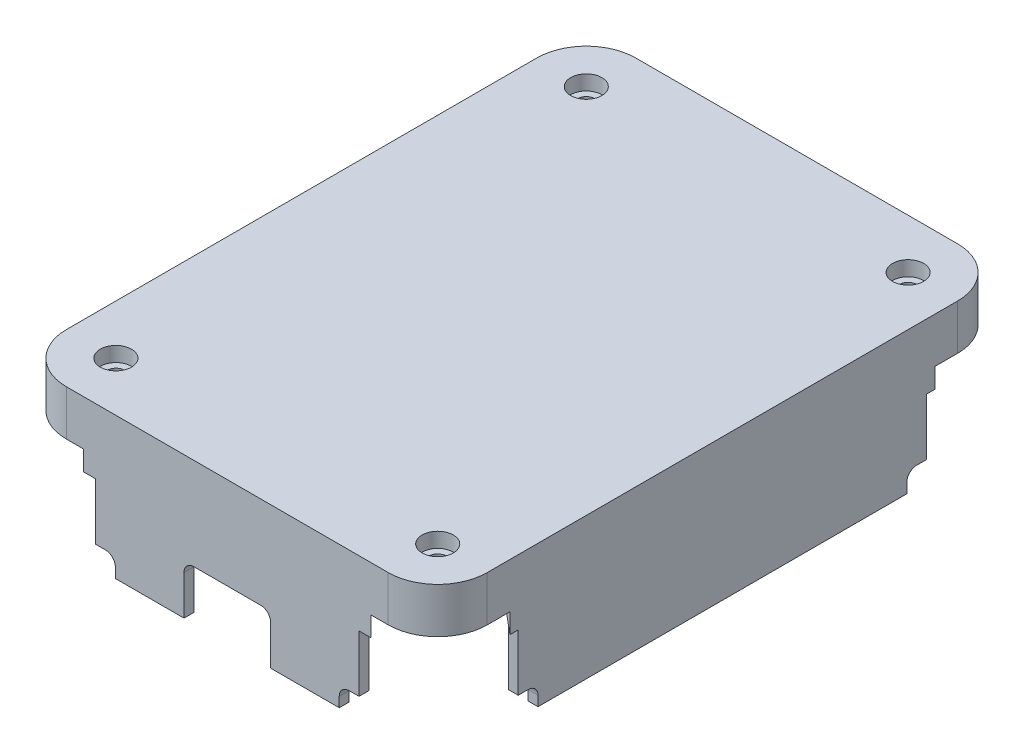
from build123d import *

# Parameters (mm, degrees)
SKETCH1_W               = 107.95
SKETCH1_H               = 146.05
BOSS_EXTRUDE1_DEPTH     = 2.54
SKETCH13_W              = 25.4
SKETCH13_H              = 25.4
BOSS_EXTRUDE4_DEPTH     = 16.71066
SKETCH2_R               = 3.302
CUT_EXTRUDE1_DEPTH      = 93.331995579
FILLET1_R               = 12.7
CUT_EXTRUDE13_DEPTH     = 5.08
SKETCH15_R              = 6.35
BOSS_EXTRUDE5_DEPTH     = 9.09066
SKETCH23_R              = 2.25
CUT_EXTRUDE14_DEPTH     = 92.549022398
SKETCH24_R              = 4
CUT_EXTRUDE15_DEPTH     = 3.81
MIRROR2_COPY_1_SKETCH_R = 2.25
MIRROR2_COPY_1_DEPTH    = 92.549022398
MIRROR2_COPY_2_SKETCH_R = 4
MIRROR2_COPY_2_DEPTH    = 3.81
FILLET3_R               = 12.7
FILLET4_R               = 1.016
SKETCH27_W              = 67.577845754
SKETCH27_H              = 2.54
SKETCH27_W_2            = 2.54
SKETCH27_H_2            = 104.761072196
BOSS_EXTRUDE6_DEPTH     = 33.782
CUT_EXTRUDE16_DEPTH     = 41.656
CUT_EXTRUDE17_DEPTH     = 136.296492227
CUT_EXTRUDE18_DEPTH     = 160.8849299
CUT_EXTRUDE19_REACH     = 161.885
SKETCH31_W              = 22.225
SKETCH31_H              = 12.7
FILLET5_R               = 2.54


with BuildPart() as part:
    # Sketch1 → Boss-Extrude1 (new body)
    with BuildSketch(Plane(origin=(0, 0, 0), x_dir=(1, 0, 0), z_dir=(0, 1, 0))):
        Rectangle(SKETCH1_W, SKETCH1_H)
    extrude(amount=-BOSS_EXTRUDE1_DEPTH)

    # Sketch13 → Boss-Extrude4 (add)
    with BuildSketch(Plane(origin=(0, 0, 0), x_dir=(1, 0, 0), z_dir=(0, 1, 0))):
        with Locations((41.275, -60.325)):
            Rectangle(SKETCH13_W, SKETCH13_H)
        with Locations((-41.275, -60.325)):
            Rectangle(SKETCH13_W, SKETCH13_H)
        with Locations((-41.275, 60.325)):
            Rectangle(SKETCH13_W, SKETCH13_H)
        with Locations((41.275, 60.325)):
            Rectangle(SKETCH13_W, SKETCH13_H)
    extrude(amount=-BOSS_EXTRUDE4_DEPTH)

    # Sketch2 → Cut-Extrude1 (cut, through all)
    with BuildSketch(Plane(origin=(0, 0, 0), x_dir=(1, 0, 0), z_dir=(0, 1, 0))):
        with Locations(Location((-41.275, 60.325, 0), (0, 0, 270))):
            Circle(SKETCH2_R)
        with Locations(Location((41.275, 60.325, 0), (0, 0, 90))):
            Circle(SKETCH2_R)
        with Locations(Location((41.275, -60.325, 0), (0, 0, 270))):
            Circle(SKETCH2_R)
        with Locations(Location((-41.275, -60.325, 0), (0, 0, 90))):
            Circle(SKETCH2_R)
    extrude(amount=-CUT_EXTRUDE1_DEPTH, mode=Mode.SUBTRACT)

    # Fillet1
    fillet1_edges = [part.edges().sort_by_distance(p)[0] for p in [
        (53.975, -8.35533, 73.025),
        (-53.975, -8.35533, 73.025),
        (-53.975, -8.35533, -73.025),
        (53.975, -8.35533, -73.025),
    ]]
    fillet(fillet1_edges, radius=FILLET1_R)

    # Sketch14 → Cut-Extrude13 (cut)
    with BuildSketch(Plane.XZ.offset(16.71066)):
        Polygon((22.4276291, -28.345857353), (6.35, -47.749892473), (138.46917676, -157.220067503), (154.54680586, -137.816032382), align=None)
        Polygon((-22.4276291, -28.345857353), (-6.35, -47.749892473), (-138.46917676, -157.220067503), (-154.54680586, -137.816032382), align=None)
        Polygon((-154.54680586, 137.816032382), (-22.4276291, 28.345857353), (-6.35, 47.749892473), (-138.46917676, 157.220067503), align=None)
        Polygon((22.4276291, 28.345857353), (6.35, 47.749892473), (138.46917676, 157.220067503), (154.54680586, 137.816032382), align=None)
    extrude(amount=-CUT_EXTRUDE13_DEPTH, mode=Mode.SUBTRACT)

    # Sketch15 → Boss-Extrude5 (add)
    with BuildSketch(Plane(origin=(0, 0, 0), x_dir=(1, 0, 0), z_dir=(0, 1, 0))):
        with Locations((-41.275, 60.325)):
            Circle(SKETCH15_R)
        with Locations((41.275, 60.325)):
            Circle(SKETCH15_R)
        with Locations((-41.275, -60.325)):
            Circle(SKETCH15_R)
        with Locations((41.275, -60.325)):
            Circle(SKETCH15_R)
    extrude(amount=-BOSS_EXTRUDE5_DEPTH)

    # Sketch23 → Cut-Extrude14 (cut, through all)
    with BuildSketch(Plane.XZ.offset(11.63066)):
        with Locations(Location((-41.275, -60.325, 0), (0, 0, 270))):
            Circle(SKETCH23_R)
    cut_extrude14 = extrude(amount=-CUT_EXTRUDE14_DEPTH, mode=Mode.SUBTRACT)

    # Sketch24 → Cut-Extrude15 (cut)
    with BuildSketch(Plane(origin=(0, 0, 0), x_dir=(1, 0, 0), z_dir=(0, 1, 0))):
        with Locations(Location((-41.275, 60.325, 0), (0, 0, 270))):
            Circle(SKETCH24_R)
    cut_extrude15 = extrude(amount=-CUT_EXTRUDE15_DEPTH, mode=Mode.SUBTRACT)

    # Mirror1: Cut-Extrude14, Cut-Extrude15 across plane
    add(cut_extrude14.mirror(Plane.XY), mode=Mode.SUBTRACT)
    add(cut_extrude15.mirror(Plane.XY), mode=Mode.SUBTRACT)

    # Mirror2: Cut-Extrude14, Cut-Extrude15 across plane
    add(cut_extrude14.mirror(Plane(origin=(0, 0, 0), x_dir=(0, 0, 1), z_dir=(1, 0, 0))), mode=Mode.SUBTRACT)
    add(cut_extrude15.mirror(Plane(origin=(0, 0, 0), x_dir=(0, 0, 1), z_dir=(1, 0, 0))), mode=Mode.SUBTRACT)

    # Mirror2 copy 1 sketch → Mirror2 copy 1 (cut, through all)
    with BuildSketch(Plane(origin=(0, -11.63066, 0), x_dir=(-1, 0, 0), z_dir=(0, -1, 0))):
        with Locations(Location((-41.275, -60.325, 0), (0, 0, 270))):
            Circle(MIRROR2_COPY_1_SKETCH_R)
    extrude(amount=-MIRROR2_COPY_1_DEPTH, mode=Mode.SUBTRACT)

    # Mirror2 copy 2 sketch → Mirror2 copy 2 (cut)
    with BuildSketch(Plane(origin=(0, 0, 0), x_dir=(-1, 0, 0), z_dir=(0, 1, 0))):
        with Locations(Location((-41.275, 60.325, 0), (0, 0, 270))):
            Circle(MIRROR2_COPY_2_SKETCH_R)
    extrude(amount=-MIRROR2_COPY_2_DEPTH, mode=Mode.SUBTRACT)

    # Fillet3
    fillet3_edges = [part.edges().sort_by_distance(p)[0] for p in [
        (28.575, -7.08533, -47.625),
        (-28.575, -7.08533, -47.625),
        (-28.575, -7.08533, 47.625),
        (28.575, -7.08533, 47.625),
    ]]
    fillet(fillet3_edges, radius=FILLET3_R)

    # Fillet4
    fillet4_edges = [part.edges().sort_by_distance(p)[0] for p in [
        (41.275, -11.63066, -57.023),
        (-41.275, -11.63066, -63.627),
        (-41.275, -11.63066, 63.627),
        (41.275, -11.63066, 57.023),
    ]]
    fillet(fillet4_edges, radius=FILLET4_R)

    # Sketch27 → Boss-Extrude6 (add)
    with BuildSketch(Plane.XZ.offset(2.54)):
        with Locations((0, -71.755)):
            Rectangle(SKETCH27_W, SKETCH27_H)
        with Locations((0, 71.755)):
            Rectangle(SKETCH27_W, SKETCH27_H)
        with Locations((52.705, 0)):
            Rectangle(SKETCH27_W_2, SKETCH27_H_2)
        with Locations((-52.705, 0)):
            Rectangle(SKETCH27_W_2, SKETCH27_H_2)
    extrude(amount=BOSS_EXTRUDE6_DEPTH)

    # Sketch28 → Cut-Extrude16 (cut)
    with BuildSketch(Plane(origin=(0, 0, -73.025), x_dir=(-1, 0, 0), z_dir=(0, 0, -1))):
        with BuildLine():
            Line((-17.526, -36.322), (17.526, -36.322))
            Line((17.526, -36.322), (29.591, -36.322))
            Line((29.591, -36.322), (29.591, -33.782))
            ThreePointArc((29.591, -33.782), (28.847051224, -31.985948776), (27.051, -31.242))
            Line((27.051, -31.242), (19.431, -31.242))
            ThreePointArc((19.431, -31.242), (17.634948776, -30.498051224), (16.891, -28.702))
            Line((16.891, -28.702), (16.891, -21.3995))
            ThreePointArc((16.891, -21.3995), (16.147051224, -19.603448776), (14.351, -18.8595))
            Line((14.351, -18.8595), (-14.351, -18.8595))
            ThreePointArc((-14.351, -18.8595), (-16.147051224, -19.603448776), (-16.891, -21.3995))
            Line((-16.891, -21.3995), (-16.891, -28.702))
            ThreePointArc((-16.891, -28.702), (-17.634948776, -30.498051224), (-19.431, -31.242))
            Line((-19.431, -31.242), (-27.051, -31.242))
            ThreePointArc((-27.051, -31.242), (-28.847051224, -31.985948776), (-29.591, -33.782))
            Line((-29.591, -33.782), (-29.591, -36.322))
            Line((-29.591, -36.322), (-17.526, -36.322))
        make_face()
    extrude(amount=-CUT_EXTRUDE16_DEPTH, mode=Mode.SUBTRACT)

    # Sketch29 → Cut-Extrude17 (cut, through all)
    with BuildSketch(Plane.ZY.offset(53.975)):
        with BuildLine():
            Line((-52.380536098, -36.322), (-47.300536098, -36.322))
            Line((-47.300536098, -36.322), (-47.300536098, -33.782))
            ThreePointArc((-47.300536098, -33.782), (-48.044484874, -31.985948776), (-49.840536098, -31.242))
            Line((-49.840536098, -31.242), (-52.380536098, -31.242))
            Line((-52.380536098, -31.242), (-52.380536098, -36.322))
        make_face()
        with BuildLine():
            Line((47.300536098, -36.322), (47.300536098, -33.782))
            ThreePointArc((47.300536098, -33.782), (48.044484874, -31.985948776), (49.840536098, -31.242))
            Line((49.840536098, -31.242), (52.380536098, -31.242))
            Line((52.380536098, -31.242), (52.380536098, -36.322))
            Line((52.380536098, -36.322), (47.300536098, -36.322))
        make_face()
    extrude(amount=-CUT_EXTRUDE17_DEPTH, mode=Mode.SUBTRACT)

    # Sketch30 → Cut-Extrude18 (cut, through all)
    with BuildSketch(Plane.XY.offset(73.025)):
        with BuildLine():
            Line((-33.788922877, -36.322), (-28.708922877, -36.322))
            Line((-28.708922877, -36.322), (-28.708922877, -33.782))
            ThreePointArc((-28.708922877, -33.782), (-29.452871653, -31.985948776), (-31.248922877, -31.242))
            Line((-31.248922877, -31.242), (-33.788922877, -31.242))
            Line((-33.788922877, -31.242), (-33.788922877, -36.322))
        make_face()
        with BuildLine():
            Line((28.708922877, -36.322), (28.708922877, -33.782))
            ThreePointArc((28.708922877, -33.782), (29.452871653, -31.985948776), (31.248922877, -31.242))
            Line((31.248922877, -31.242), (33.788922877, -31.242))
            Line((33.788922877, -31.242), (33.788922877, -36.322))
            Line((33.788922877, -36.322), (28.708922877, -36.322))
        make_face()
    extrude(amount=-CUT_EXTRUDE18_DEPTH, mode=Mode.SUBTRACT)

    # Sketch31 → Cut-Extrude19 (cut, up to next)
    with BuildSketch(Plane.XY.offset(73.025), mode=Mode.PRIVATE) as cut_extrude19_sk1:
        with Locations((0, -29.972)):
            Rectangle(SKETCH31_W, SKETCH31_H)
    cut_extrude19_tool1 = extrude(cut_extrude19_sk1.sketch, amount=-CUT_EXTRUDE19_REACH, mode=Mode.PRIVATE) & part.part
    add(cut_extrude19_tool1.solids().sort_by_distance((0, -29.972, 73.025))[0], mode=Mode.SUBTRACT)

    # Fillet5
    fillet5_edges = [part.edges().sort_by_distance(p)[0] for p in [
        (-11.1125, -23.622, 71.755),
        (11.1125, -23.622, 71.755),
    ]]
    fillet(fillet5_edges, radius=FILLET5_R)


solid = part.part
